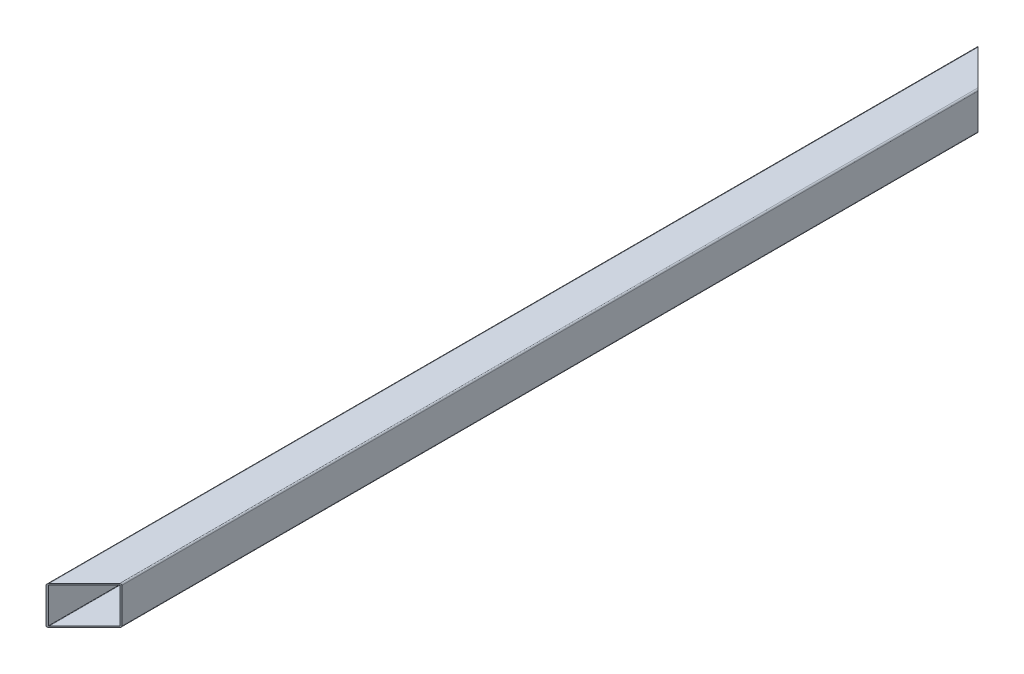
from build123d import *

# Parameters (mm, degrees)
STRUCTURAL_MEMBER1_DEPTH = 980
CUT_EXTRUDE1_DEPTH       = 50


with BuildPart() as part:
    # Sketch12 → Structural Member1 (new body)
    with BuildSketch(Plane(origin=(0, 0, 0), x_dir=(-1, 0, 0), z_dir=(0, 0, -1))):
        with BuildLine():
            Line((-18.5, -20), (18.5, -20))
            ThreePointArc((18.5, -20), (19.560660172, -19.560660172), (20, -18.5))
            Line((20, -18.5), (20, 18.5))
            ThreePointArc((20, 18.5), (19.560660172, 19.560660172), (18.5, 20))
            Line((18.5, 20), (-18.5, 20))
            ThreePointArc((-18.5, 20), (-19.560660172, 19.560660172), (-20, 18.5))
            Line((-20, 18.5), (-20, -18.5))
            ThreePointArc((-20, -18.5), (-19.560660172, -19.560660172), (-18.5, -20))
        make_face()
        with BuildLine():
            Line((-18.5, -18.8), (18.5, -18.8))
            ThreePointArc((18.5, -18.8), (18.712132034, -18.712132034), (18.8, -18.5))
            Line((18.8, -18.5), (18.8, 18.5))
            ThreePointArc((18.8, 18.5), (18.712132034, 18.712132034), (18.5, 18.8))
            Line((18.5, 18.8), (-18.5, 18.8))
            ThreePointArc((-18.5, 18.8), (-18.712132034, 18.712132034), (-18.8, 18.5))
            Line((-18.8, 18.5), (-18.8, -18.5))
            ThreePointArc((-18.8, -18.5), (-18.712132034, -18.712132034), (-18.5, -18.8))
        make_face(mode=Mode.SUBTRACT)
    extrude(amount=STRUCTURAL_MEMBER1_DEPTH)

    # Sketch13 → Cut-Extrude1 (cut)
    with BuildSketch(Plane(origin=(0, 20, 0), x_dir=(1, 0, 0), z_dir=(0, 1, 0))):
        Polygon((-20, 980), (33.390807619, 926.609192381), (46.736117165, 1004.399995298), align=None)
        Polygon((46.736117165, -24.399995298), (33.390807619, 53.390807619), (-20, 0), align=None)
    extrude(amount=-CUT_EXTRUDE1_DEPTH, mode=Mode.SUBTRACT)


solid = part.part
